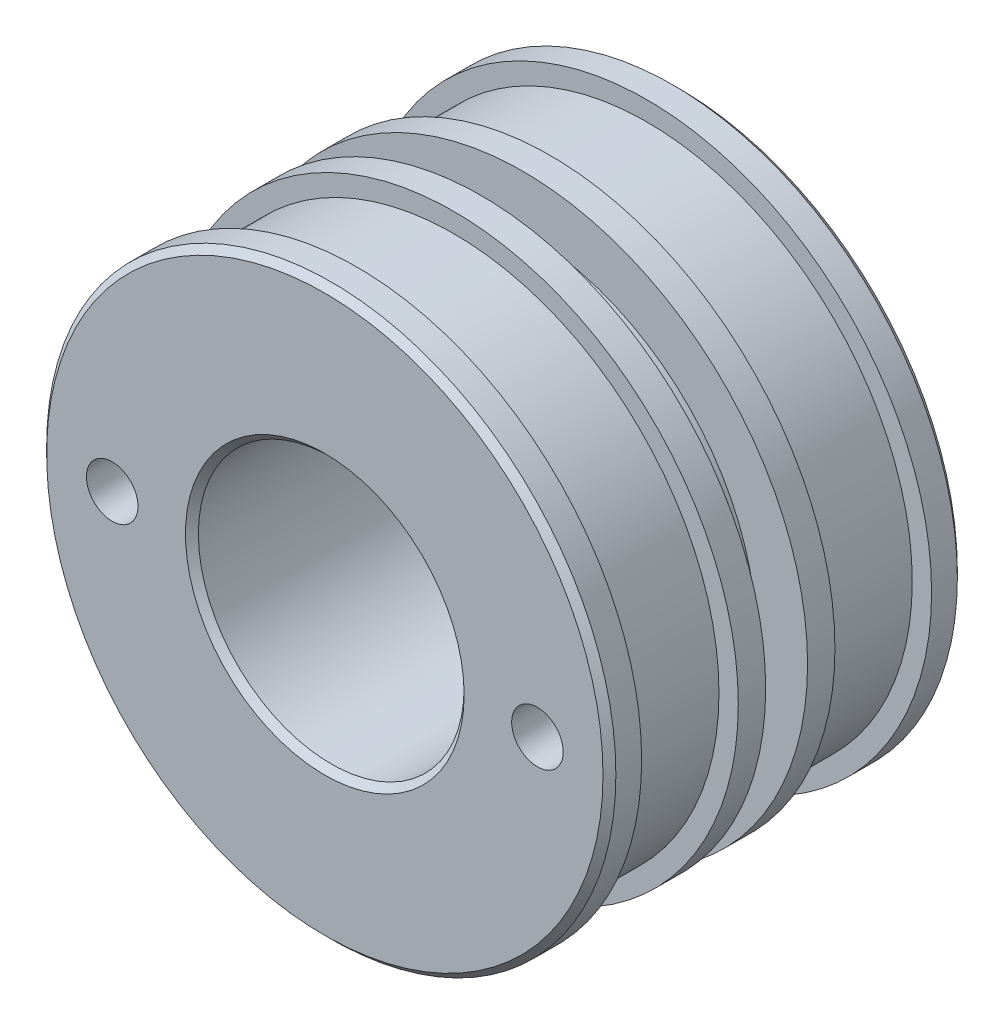
from build123d import *

# Parameters (mm, degrees)
SZKIC1_R                    = 44.175
SZKIC1_R_2                  = 20.625
DODANIE_WYCI_GNI_CIE1_DEPTH = 55
SZKIC2_W                    = 15
SZKIC2_H                    = 3
SZKIC2_W_2                  = 6.5
SZKIC2_H_2                  = 8
SFAZOWANIE1_SIZE            = 1
SZKIC3_R                    = 24.5
WYTNIJ_WYCI_GNI_CIE1_DEPTH  = 15
SFAZOWANIE2_SIZE            = 1
SZKIC5_R                    = 4
WYTNIJ_WYCI_GNI_CIE2_DEPTH  = 9


with BuildPart() as part:
    # Szkic1 → Dodanie-wyciągnięcie1 (new body)
    with BuildSketch(Plane.XY):
        Circle(SZKIC1_R)
        Circle(SZKIC1_R_2, mode=Mode.SUBTRACT)
    extrude(amount=-DODANIE_WYCI_GNI_CIE1_DEPTH)

    # Szkic2 → Wycięcie-obrót1 (revolve, cut)
    with BuildSketch(Plane(origin=(0, 0, 0), x_dir=(0, 0, -1), z_dir=(1, 0, 0)), mode=Mode.PRIVATE) as wyci_cie_obr_t1_sk:
        with Locations((12.5, 42.675)):
            Rectangle(SZKIC2_W, SZKIC2_H)
        with Locations((27.5, 40.175)):
            Rectangle(SZKIC2_W_2, SZKIC2_H_2)
        with Locations((42.5, 42.675)):
            Rectangle(SZKIC2_W, SZKIC2_H)
    revolve(wyci_cie_obr_t1_sk.sketch.rotate(Axis((0, 0, 0), (0, 0, -1)), 90), axis=Axis((0, 0, 0), (0, 0, -1)), mode=Mode.SUBTRACT)

    # Sfazowanie1
    sfazowanie1_edges = [part.edges().sort_by_distance(p)[0] for p in [
        (-44.175, 0, 0),
        (-44.175, 0, -55),
        (-20.625, 0, -55),
        (-20.625, 0, 0),
    ]]
    chamfer(sfazowanie1_edges, length=SFAZOWANIE1_SIZE)

    # Szkic3 → Wytnij-wyciągnięcie1 (cut)
    with BuildSketch(Plane(origin=(0, 0, -55), x_dir=(-1, 0, 0), z_dir=(0, 0, -1))):
        Circle(SZKIC3_R)
    extrude(amount=-WYTNIJ_WYCI_GNI_CIE1_DEPTH, mode=Mode.SUBTRACT)

    # Sfazowanie2
    sfazowanie2_edges = [part.edges().sort_by_distance(p)[0] for p in [
        (24.5, 0, -55),
    ]]
    chamfer(sfazowanie2_edges, length=SFAZOWANIE2_SIZE)

    # Szkic5 → Wytnij-wyciągnięcie2 (cut)
    with BuildSketch(Plane.XY):
        with Locations((-33, 0)):
            Circle(SZKIC5_R)
        with Locations((33, 0)):
            Circle(SZKIC5_R)
    extrude(amount=-WYTNIJ_WYCI_GNI_CIE2_DEPTH, mode=Mode.SUBTRACT)


solid = part.part
